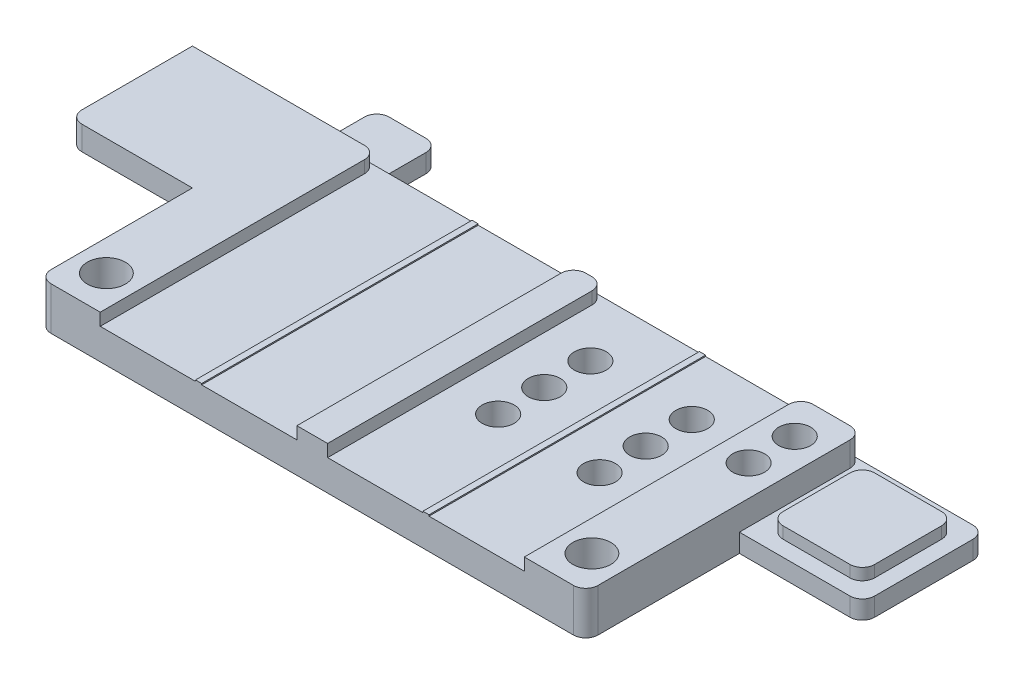
from build123d import *

# Parameters (mm, degrees)
SKETCH1_W             = 15.5
SKETCH1_H             = 45
BOSS_EXTRUDE1_DEPTH   = 5
BOSS_EXTRUDE1_2_DEPTH = 5
SKETCH1_R             = 2.6
BOSS_EXTRUDE1_3_DEPTH = 5
BOSS_EXTRUDE1_4_DEPTH = 5
SKETCH1_3_W           = 1
SKETCH1_3_H           = 45
BOSS_EXTRUDE2_DEPTH   = 5.2
SKETCH1_4_W           = 5
SKETCH1_4_H           = 45
SKETCH1_4_W_2         = 10
SKETCH1_4_R           = 2.6
BOSS_EXTRUDE3_DEPTH   = 7
SKETCH2_W             = 7.5
SKETCH2_H             = 15
CUT_EXTRUDE1_DEPTH    = 1.1
SKETCH3_R             = 3.1
CUT_EXTRUDE2_DEPTH    = 152.506600516
SKETCH5_W             = 20
SKETCH5_H             = 20
SKETCH5_W_2           = 14.9
SKETCH5_H_2           = 14.9
BOSS_EXTRUDE4_DEPTH   = 3
SKETCH5_3_W           = 14.9
SKETCH5_3_H           = 14.9
BOSS_EXTRUDE5_DEPTH   = 4.9
BOSS_EXTRUDE6_START   = 7
SKETCH5_4_W           = 20
SKETCH5_4_H           = 20
SKETCH5_4_W_2         = 15.2
SKETCH5_4_H_2         = 15.2
BOSS_EXTRUDE6_DEPTH   = 3.9
BOSS_EXTRUDE7_START   = 7
SKETCH5_5_W           = 15.2
SKETCH5_5_H           = 15.2
BOSS_EXTRUDE7_DEPTH   = 1
FILLET1_R             = 2
BOSS_EXTRUDE8_START   = -7
SKETCH6_W             = 10
SKETCH6_H             = 10
BOSS_EXTRUDE8_DEPTH   = 3
FILLET3_R             = 2
CHAMFER1_SIZE         = 1


with BuildPart() as part:
    # Sketch1 → Boss-Extrude1 (new body)
    with BuildSketch(Plane(origin=(0, 0, 0), x_dir=(1, 0, 0), z_dir=(0, 1, 0))):
        with Locations((73.25, 22.5)):
            Rectangle(SKETCH1_W, SKETCH1_H)
    extrude(amount=BOSS_EXTRUDE1_DEPTH)



with BuildPart() as body_2:
    # Sketch1 → Boss-Extrude1 2 (new body)
    with BuildSketch(Plane(origin=(0, 0, 0), x_dir=(1, 0, 0), z_dir=(0, 1, 0))):
        with Locations((89.75, 22.5)):
            Rectangle(SKETCH1_W, SKETCH1_H)
    extrude(amount=BOSS_EXTRUDE1_2_DEPTH)


with BuildPart() as body_3:
    # Sketch1 → Boss-Extrude1 3 (new body)
    with BuildSketch(Plane(origin=(0, 0, 0), x_dir=(1, 0, 0), z_dir=(0, 1, 0))):
        with Locations((110.25, 22.5)):
            Rectangle(SKETCH1_W, SKETCH1_H)
        with Locations(Location((110.25, 20, 0), (0, 0, 270))):
            Circle(SKETCH1_R, mode=Mode.SUBTRACT)
        with Locations(Location((110.25, 27.5, 0), (0, 0, 270))):
            Circle(SKETCH1_R, mode=Mode.SUBTRACT)
        with Locations(Location((110.25, 35, 0), (0, 0, 270))):
            Circle(SKETCH1_R, mode=Mode.SUBTRACT)
    extrude(amount=BOSS_EXTRUDE1_3_DEPTH)


with BuildPart() as body_4:
    # Sketch1 → Boss-Extrude1 4 (new body)
    with BuildSketch(Plane(origin=(0, 0, 0), x_dir=(1, 0, 0), z_dir=(0, 1, 0))):
        with Locations((126.75, 22.5)):
            Rectangle(SKETCH1_W, SKETCH1_H)
        with Locations(Location((126.75, 20, 0), (0, 0, 270))):
            Circle(SKETCH1_R, mode=Mode.SUBTRACT)
        with Locations(Location((126.75, 27.5, 0), (0, 0, 270))):
            Circle(SKETCH1_R, mode=Mode.SUBTRACT)
        with Locations(Location((126.75, 35, 0), (0, 0, 270))):
            Circle(SKETCH1_R, mode=Mode.SUBTRACT)
    extrude(amount=BOSS_EXTRUDE1_4_DEPTH)


with BuildPart() as part_1:
    add(part.part)

    add(body_2.part)  # Boss-Extrude2 merges body 2

    add(body_3.part)  # Boss-Extrude2 merges body 3

    add(body_4.part)  # Boss-Extrude2 merges body 4
    # Sketch1<3> → Boss-Extrude2 (add)
    with BuildSketch(Plane(origin=(0, 0, 0), x_dir=(1, 0, 0), z_dir=(0, 1, 0))):
        with Locations((81.5, 22.5)):
            Rectangle(SKETCH1_3_W, SKETCH1_3_H)
        with Locations((118.5, 22.5)):
            Rectangle(SKETCH1_3_W, SKETCH1_3_H)
    extrude(amount=BOSS_EXTRUDE2_DEPTH)

    # Sketch1<4> → Boss-Extrude3 (add)
    # profile 1 of 3: a face of its own
    with BuildSketch(Plane(origin=(0, 0, 0), x_dir=(1, 0, 0), z_dir=(0, 1, 0))):
        with Locations((100, 22.5)):
            Rectangle(SKETCH1_4_W, SKETCH1_4_H)
    # profile 2 of 3: a face of its own
    with BuildSketch(Plane(origin=(0, 0, 0), x_dir=(1, 0, 0), z_dir=(0, 1, 0))):
        with Locations((139.5, 22.5)):
            Rectangle(SKETCH1_4_W_2, SKETCH1_4_H)
        with Locations(Location((139.5, 31.5, 0), (0, 0, 270))):
            Circle(SKETCH1_4_R, mode=Mode.SUBTRACT)
        with Locations(Location((139.5, 39, 0), (0, 0, 270))):
            Circle(SKETCH1_4_R, mode=Mode.SUBTRACT)
    # profile 3 of 3: a face of its own
    with BuildSketch(Plane(origin=(0, 0, 0), x_dir=(1, 0, 0), z_dir=(0, 1, 0))):
        with Locations((60.5, 22.5)):
            Rectangle(SKETCH1_4_W_2, SKETCH1_4_H)
    extrude(amount=BOSS_EXTRUDE3_DEPTH)

    # Sketch2 → Cut-Extrude1 (cut)
    with BuildSketch(Plane(origin=(0, 0, 0), x_dir=(-1, 0, 0), z_dir=(0, -1, 0))):
        with Locations((-139.5, 35.25)):
            Rectangle(SKETCH2_W, SKETCH2_H)
    extrude(amount=-CUT_EXTRUDE1_DEPTH, mode=Mode.SUBTRACT)

    # Sketch3 → Cut-Extrude2 (cut, through all)
    with BuildSketch(Plane(origin=(0, 7, 0), x_dir=(1, 0, 0), z_dir=(0, 1, 0))):
        with Locations(Location((60.5, 6, 0), (0, 0, 270))):
            Circle(SKETCH3_R)
        with Locations(Location((139.5, 6, 0), (0, 0, 90))):
            Circle(SKETCH3_R)
    extrude(amount=-CUT_EXTRUDE2_DEPTH, mode=Mode.SUBTRACT)

    # Sketch5 → Boss-Extrude4 (add)
    # profile 1 of 2: a face of its own
    with BuildSketch(Plane(origin=(0, 0, 0), x_dir=(1, 0, 0), z_dir=(0, 1, 0))):
        with Locations((154.5, 35)):
            Rectangle(SKETCH5_W, SKETCH5_H)
        with Locations((154.5, 35)):
            Rectangle(SKETCH5_W_2, SKETCH5_H_2, mode=Mode.SUBTRACT)
    # profile 2 of 2: a face of its own
    with BuildSketch(Plane(origin=(0, 0, 0), x_dir=(1, 0, 0), z_dir=(0, 1, 0))):
        with Locations((154.5, 35)):
            Rectangle(SKETCH5_W_2, SKETCH5_H_2)
    extrude(amount=BOSS_EXTRUDE4_DEPTH)

    # Sketch5<3> → Boss-Extrude5 (add)
    with BuildSketch(Plane(origin=(0, 0, 0), x_dir=(1, 0, 0), z_dir=(0, 1, 0))):
        with Locations((154.5, 35)):
            Rectangle(SKETCH5_3_W, SKETCH5_3_H)
    extrude(amount=BOSS_EXTRUDE5_DEPTH)

    # Sketch5<4> → Boss-Extrude6 (add)
    with BuildSketch(Plane(origin=(0, 0, 0), x_dir=(1, 0, 0), z_dir=(0, 1, 0)).offset(BOSS_EXTRUDE6_START)):
        with Locations((45.5, 35)):
            Rectangle(SKETCH5_4_W, SKETCH5_4_H)
        with Locations((45.5, 35)):
            Rectangle(SKETCH5_4_W_2, SKETCH5_4_H_2, mode=Mode.SUBTRACT)
    extrude(amount=-BOSS_EXTRUDE6_DEPTH)

    # Sketch5<5> → Boss-Extrude7 (add)
    with BuildSketch(Plane(origin=(0, 0, 0), x_dir=(1, 0, 0), z_dir=(0, 1, 0)).offset(BOSS_EXTRUDE7_START)):
        with Locations((45.5, 35)):
            Rectangle(SKETCH5_5_W, SKETCH5_5_H)
    extrude(amount=-BOSS_EXTRUDE7_DEPTH)

    # Fillet1
    fillet1_edges = [part_1.edges().sort_by_distance(p)[0] for p in [
        (161.95, 3.95, -42.45),
        (147.05, 3.95, -42.45),
        (147.05, 3.95, -27.55),
        (161.95, 3.95, -27.55),
    ]]
    fillet(fillet1_edges, radius=FILLET1_R)

    # Sketch6 → Boss-Extrude8 (add)
    with BuildSketch(Plane(origin=(0, 7, 0), x_dir=(1, 0, 0), z_dir=(0, 1, 0)).offset(BOSS_EXTRUDE8_START)):
        with Locations((60.5, 50)):
            Rectangle(SKETCH6_W, SKETCH6_H)
    extrude(amount=BOSS_EXTRUDE8_DEPTH)

    # Fillet3
    fillet3_edges = [part_1.edges().sort_by_distance(p)[0] for p in [
        (164.5, 1.5, -45),
        (164.5, 1.5, -25),
        (35.5, 5.05, -25),
        (65.5, 1.5, -55),
        (55.5, 1.5, -55),
        (97.5, 6, -45),
        (102.5, 6, -45),
        (134.5, 6, -45),
        (144.5, 3.5, 0),
        (144.5, 5, -45),
        (55.5, 3.5, 0),
        (65.5, 6, -45),
    ]]
    fillet(fillet3_edges, radius=FILLET3_R)

    # Chamfer1
    chamfer1_edges = [part_1.edges().sort_by_distance(p)[0] for p in [
        (45.5, 3.1, -45),
    ]]
    chamfer(chamfer1_edges, length=CHAMFER1_SIZE)


solid = part_1.part
